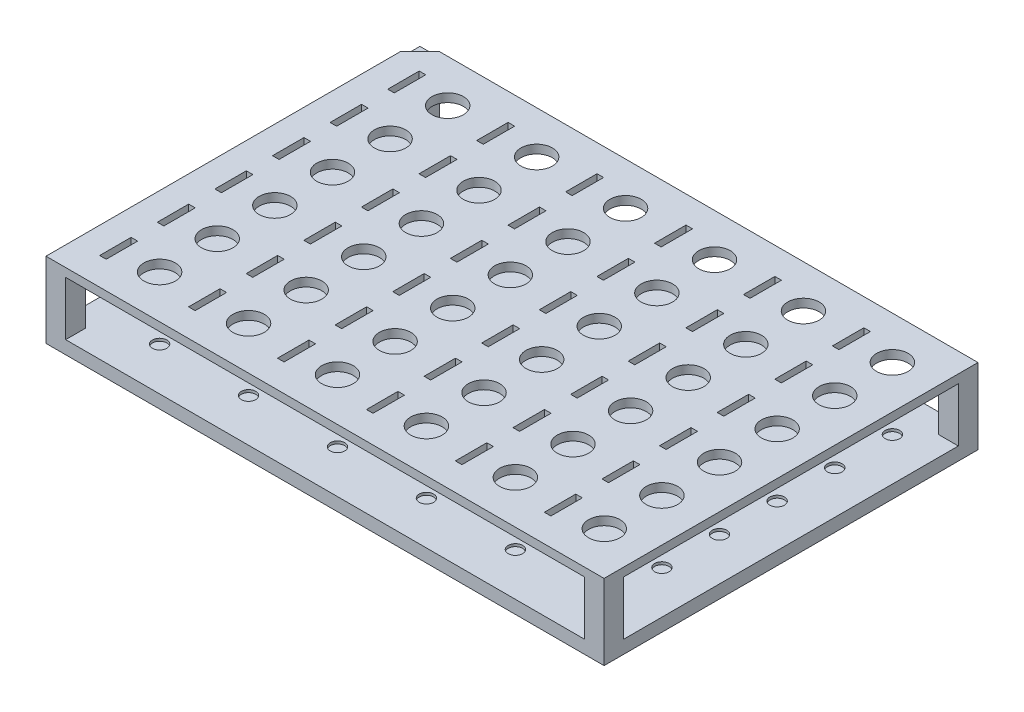
from build123d import *

# Parameters (mm, degrees)
SKETCH1_W           = 127.76
SKETCH1_H           = 85.6
BOSS_EXTRUDE1_DEPTH = 3
SKETCH10_R          = 1.65
CUT_EXTRUDE2_DEPTH  = 0.6
SKETCH2_W           = 4.5
SKETCH2_H           = 4.5
BOSS_EXTRUDE2_DEPTH = 14.3
SKETCH6_W           = 127.76
SKETCH6_H           = 85.6
BOSS_EXTRUDE4_DEPTH = 1.95
SKETCH7_R           = 3.6
SKETCH7_W           = 1.5
SKETCH7_H           = 7.2
CUT_EXTRUDE1_DEPTH  = 3
CUT_EXTRUDE3_DEPTH  = 1.2


with BuildPart() as part:
    # Sketch1 → Boss-Extrude1 (new body)
    with BuildSketch(Plane(origin=(0, 0, 0), x_dir=(1, 0, 0), z_dir=(0, 1, 0))):
        Rectangle(SKETCH1_W, SKETCH1_H)
    extrude(amount=BOSS_EXTRUDE1_DEPTH)

    # Sketch10 → Cut-Extrude2 (cut)
    with BuildSketch(Plane(origin=(0, 3, 0), x_dir=(1, 0, 0), z_dir=(0, 1, 0))):
        with Locations(Location((-47.74, 33.02, 0), (0, 0, 270))):
            Circle(SKETCH10_R)
        with Locations(Location((-27.38, 33.02, 0), (0, 0, 270))):
            Circle(SKETCH10_R)
        with Locations(Location((-7.02, 33.02, 0), (0, 0, 270))):
            Circle(SKETCH10_R)
        with Locations(Location((13.34, 33.02, 0), (0, 0, 270))):
            Circle(SKETCH10_R)
        with Locations(Location((33.7, 33.02, 0), (0, 0, 270))):
            Circle(SKETCH10_R)
        with Locations(Location((54.06, 33.02, 0), (0, 0, 270))):
            Circle(SKETCH10_R)
        with Locations(Location((-47.74, 19.83, 0), (0, 0, 270))):
            Circle(SKETCH10_R)
        with Locations(Location((-27.38, 19.83, 0), (0, 0, 270))):
            Circle(SKETCH10_R)
        with Locations(Location((-7.02, 19.83, 0), (0, 0, 270))):
            Circle(SKETCH10_R)
        with Locations(Location((13.34, 19.83, 0), (0, 0, 270))):
            Circle(SKETCH10_R)
        with Locations(Location((33.7, 19.83, 0), (0, 0, 270))):
            Circle(SKETCH10_R)
        with Locations(Location((54.06, 19.83, 0), (0, 0, 270))):
            Circle(SKETCH10_R)
        with Locations(Location((-47.74, 6.64, 0), (0, 0, 270))):
            Circle(SKETCH10_R)
        with Locations(Location((-27.38, 6.64, 0), (0, 0, 270))):
            Circle(SKETCH10_R)
        with Locations(Location((-7.02, 6.64, 0), (0, 0, 270))):
            Circle(SKETCH10_R)
        with Locations(Location((13.34, 6.64, 0), (0, 0, 270))):
            Circle(SKETCH10_R)
        with Locations(Location((33.7, 6.64, 0), (0, 0, 270))):
            Circle(SKETCH10_R)
        with Locations(Location((54.06, 6.64, 0), (0, 0, 270))):
            Circle(SKETCH10_R)
        with Locations(Location((-47.74, -6.55, 0), (0, 0, 270))):
            Circle(SKETCH10_R)
        with Locations(Location((-27.38, -6.55, 0), (0, 0, 270))):
            Circle(SKETCH10_R)
        with Locations(Location((-7.02, -6.55, 0), (0, 0, 270))):
            Circle(SKETCH10_R)
        with Locations(Location((13.34, -6.55, 0), (0, 0, 270))):
            Circle(SKETCH10_R)
        with Locations(Location((33.7, -6.55, 0), (0, 0, 270))):
            Circle(SKETCH10_R)
        with Locations(Location((54.06, -6.55, 0), (0, 0, 270))):
            Circle(SKETCH10_R)
        with Locations(Location((-47.74, -19.74, 0), (0, 0, 270))):
            Circle(SKETCH10_R)
        with Locations(Location((-27.38, -19.74, 0), (0, 0, 270))):
            Circle(SKETCH10_R)
        with Locations(Location((-7.02, -19.74, 0), (0, 0, 270))):
            Circle(SKETCH10_R)
        with Locations(Location((13.34, -19.74, 0), (0, 0, 270))):
            Circle(SKETCH10_R)
        with Locations(Location((33.7, -19.74, 0), (0, 0, 270))):
            Circle(SKETCH10_R)
        with Locations(Location((54.06, -19.74, 0), (0, 0, 270))):
            Circle(SKETCH10_R)
        with Locations(Location((-47.74, -32.93, 0), (0, 0, 270))):
            Circle(SKETCH10_R)
        with Locations(Location((-27.38, -32.93, 0), (0, 0, 270))):
            Circle(SKETCH10_R)
        with Locations(Location((-7.02, -32.93, 0), (0, 0, 270))):
            Circle(SKETCH10_R)
        with Locations(Location((13.34, -32.93, 0), (0, 0, 270))):
            Circle(SKETCH10_R)
        with Locations(Location((33.7, -32.93, 0), (0, 0, 270))):
            Circle(SKETCH10_R)
        with Locations(Location((54.06, -32.93, 0), (0, 0, 270))):
            Circle(SKETCH10_R)
    extrude(amount=-CUT_EXTRUDE2_DEPTH, mode=Mode.SUBTRACT)

    # Sketch2 → Boss-Extrude2 (add)
    with BuildSketch(Plane(origin=(0, 3, 0), x_dir=(1, 0, 0), z_dir=(0, 1, 0))):
        with Locations((-61.63, 40.55)):
            Rectangle(SKETCH2_W, SKETCH2_H)
        with Locations((61.63, 40.55)):
            Rectangle(SKETCH2_W, SKETCH2_H)
        with Locations((61.63, -40.55)):
            Rectangle(SKETCH2_W, SKETCH2_H)
        with Locations((-61.63, -40.55)):
            Rectangle(SKETCH2_W, SKETCH2_H)
    extrude(amount=BOSS_EXTRUDE2_DEPTH)

    # Sketch6 → Boss-Extrude4 (add)
    with BuildSketch(Plane(origin=(0, 17.3, 0), x_dir=(1, 0, 0), z_dir=(0, 1, 0))):
        Rectangle(SKETCH6_W, SKETCH6_H)
    extrude(amount=-BOSS_EXTRUDE4_DEPTH)

    # Sketch7 → Cut-Extrude1 (cut)
    with BuildSketch(Plane(origin=(0, 17.3, 0), x_dir=(1, 0, 0), z_dir=(0, 1, 0))):
        with Locations(Location((54.055, 33.025, 0), (0, 0, 270))):
            Circle(SKETCH7_R)
        with Locations(Location((54.055, 19.835, 0), (0, 0, 270))):
            Circle(SKETCH7_R)
        with Locations(Location((54.055, 6.645, 0), (0, 0, 270))):
            Circle(SKETCH7_R)
        with Locations(Location((54.055, -6.545, 0), (0, 0, 270))):
            Circle(SKETCH7_R)
        with Locations(Location((54.055, -19.735, 0), (0, 0, 270))):
            Circle(SKETCH7_R)
        with Locations(Location((54.055, -32.925, 0), (0, 0, 270))):
            Circle(SKETCH7_R)
        with Locations(Location((33.695, 33.025, 0), (0, 0, 270))):
            Circle(SKETCH7_R)
        with Locations(Location((33.695, 19.835, 0), (0, 0, 270))):
            Circle(SKETCH7_R)
        with Locations(Location((33.695, 6.645, 0), (0, 0, 270))):
            Circle(SKETCH7_R)
        with Locations(Location((33.695, -6.545, 0), (0, 0, 270))):
            Circle(SKETCH7_R)
        with Locations(Location((33.695, -19.735, 0), (0, 0, 270))):
            Circle(SKETCH7_R)
        with Locations(Location((33.695, -32.925, 0), (0, 0, 270))):
            Circle(SKETCH7_R)
        with Locations(Location((13.335, 33.025, 0), (0, 0, 270))):
            Circle(SKETCH7_R)
        with Locations(Location((13.335, 19.835, 0), (0, 0, 270))):
            Circle(SKETCH7_R)
        with Locations(Location((13.335, 6.645, 0), (0, 0, 270))):
            Circle(SKETCH7_R)
        with Locations(Location((13.335, -6.545, 0), (0, 0, 270))):
            Circle(SKETCH7_R)
        with Locations(Location((13.335, -19.735, 0), (0, 0, 270))):
            Circle(SKETCH7_R)
        with Locations(Location((13.335, -32.925, 0), (0, 0, 270))):
            Circle(SKETCH7_R)
        with Locations(Location((-7.025, 33.025, 0), (0, 0, 270))):
            Circle(SKETCH7_R)
        with Locations(Location((-7.025, 19.835, 0), (0, 0, 270))):
            Circle(SKETCH7_R)
        with Locations(Location((-7.025, 6.645, 0), (0, 0, 270))):
            Circle(SKETCH7_R)
        with Locations(Location((-7.025, -6.545, 0), (0, 0, 270))):
            Circle(SKETCH7_R)
        with Locations(Location((-7.025, -19.735, 0), (0, 0, 270))):
            Circle(SKETCH7_R)
        with Locations(Location((-7.025, -32.925, 0), (0, 0, 270))):
            Circle(SKETCH7_R)
        with Locations(Location((-27.385, 33.025, 0), (0, 0, 270))):
            Circle(SKETCH7_R)
        with Locations(Location((-27.385, 19.835, 0), (0, 0, 270))):
            Circle(SKETCH7_R)
        with Locations(Location((-27.385, 6.645, 0), (0, 0, 270))):
            Circle(SKETCH7_R)
        with Locations(Location((-27.385, -6.545, 0), (0, 0, 270))):
            Circle(SKETCH7_R)
        with Locations(Location((-27.385, -19.735, 0), (0, 0, 270))):
            Circle(SKETCH7_R)
        with Locations(Location((-27.385, -32.925, 0), (0, 0, 270))):
            Circle(SKETCH7_R)
        with Locations(Location((-47.745, 33.025, 0), (0, 0, 270))):
            Circle(SKETCH7_R)
        with Locations(Location((-47.745, 19.835, 0), (0, 0, 270))):
            Circle(SKETCH7_R)
        with Locations(Location((-47.745, 6.645, 0), (0, 0, 270))):
            Circle(SKETCH7_R)
        with Locations(Location((-47.745, -6.545, 0), (0, 0, 270))):
            Circle(SKETCH7_R)
        with Locations(Location((-47.745, -19.735, 0), (0, 0, 270))):
            Circle(SKETCH7_R)
        with Locations(Location((-47.745, -32.925, 0), (0, 0, 270))):
            Circle(SKETCH7_R)
        with Locations((24.315, 33.025)):
            Rectangle(SKETCH7_W, SKETCH7_H)
        with Locations((44.675, 33.025)):
            Rectangle(SKETCH7_W, SKETCH7_H)
        with Locations((3.955, 33.025)):
            Rectangle(SKETCH7_W, SKETCH7_H)
        with Locations((-16.405, 33.025)):
            Rectangle(SKETCH7_W, SKETCH7_H)
        with Locations((-36.765, 33.025)):
            Rectangle(SKETCH7_W, SKETCH7_H)
        with Locations((-57.125, 33.025)):
            Rectangle(SKETCH7_W, SKETCH7_H)
        with Locations((24.315, 19.835)):
            Rectangle(SKETCH7_W, SKETCH7_H)
        with Locations((44.675, 19.835)):
            Rectangle(SKETCH7_W, SKETCH7_H)
        with Locations((3.955, 19.835)):
            Rectangle(SKETCH7_W, SKETCH7_H)
        with Locations((-16.405, 19.835)):
            Rectangle(SKETCH7_W, SKETCH7_H)
        with Locations((-36.765, 19.835)):
            Rectangle(SKETCH7_W, SKETCH7_H)
        with Locations((-57.125, 19.835)):
            Rectangle(SKETCH7_W, SKETCH7_H)
        with Locations((24.315, 6.645)):
            Rectangle(SKETCH7_W, SKETCH7_H)
        with Locations((44.675, 6.645)):
            Rectangle(SKETCH7_W, SKETCH7_H)
        with Locations((3.955, 6.645)):
            Rectangle(SKETCH7_W, SKETCH7_H)
        with Locations((-16.405, 6.645)):
            Rectangle(SKETCH7_W, SKETCH7_H)
        with Locations((-36.765, 6.645)):
            Rectangle(SKETCH7_W, SKETCH7_H)
        with Locations((-57.125, 6.645)):
            Rectangle(SKETCH7_W, SKETCH7_H)
        with Locations((24.315, -6.545)):
            Rectangle(SKETCH7_W, SKETCH7_H)
        with Locations((44.675, -6.545)):
            Rectangle(SKETCH7_W, SKETCH7_H)
        with Locations((3.955, -6.545)):
            Rectangle(SKETCH7_W, SKETCH7_H)
        with Locations((-16.405, -6.545)):
            Rectangle(SKETCH7_W, SKETCH7_H)
        with Locations((-36.765, -6.545)):
            Rectangle(SKETCH7_W, SKETCH7_H)
        with Locations((-57.125, -6.545)):
            Rectangle(SKETCH7_W, SKETCH7_H)
        with Locations((24.315, -19.735)):
            Rectangle(SKETCH7_W, SKETCH7_H)
        with Locations((44.675, -19.735)):
            Rectangle(SKETCH7_W, SKETCH7_H)
        with Locations((3.955, -19.735)):
            Rectangle(SKETCH7_W, SKETCH7_H)
        with Locations((-16.405, -19.735)):
            Rectangle(SKETCH7_W, SKETCH7_H)
        with Locations((-36.765, -19.735)):
            Rectangle(SKETCH7_W, SKETCH7_H)
        with Locations((-57.125, -19.735)):
            Rectangle(SKETCH7_W, SKETCH7_H)
        with Locations((24.315, -32.925)):
            Rectangle(SKETCH7_W, SKETCH7_H)
        with Locations((44.675, -32.925)):
            Rectangle(SKETCH7_W, SKETCH7_H)
        with Locations((3.955, -32.925)):
            Rectangle(SKETCH7_W, SKETCH7_H)
        with Locations((-16.405, -32.925)):
            Rectangle(SKETCH7_W, SKETCH7_H)
        with Locations((-36.765, -32.925)):
            Rectangle(SKETCH7_W, SKETCH7_H)
        with Locations((-57.125, -32.925)):
            Rectangle(SKETCH7_W, SKETCH7_H)
    extrude(amount=-CUT_EXTRUDE1_DEPTH, mode=Mode.SUBTRACT)

    # Sketch11 → Cut-Extrude3 (cut)
    with BuildSketch(Plane(origin=(0, 17.3, 0), x_dir=(1, 0, 0), z_dir=(0, 1, 0))):
        Polygon((-63.88, 42.8), (-59.38, 42.8), (-63.88, 38.3), align=None)
    extrude(amount=-CUT_EXTRUDE3_DEPTH, mode=Mode.SUBTRACT)


solid = part.part
